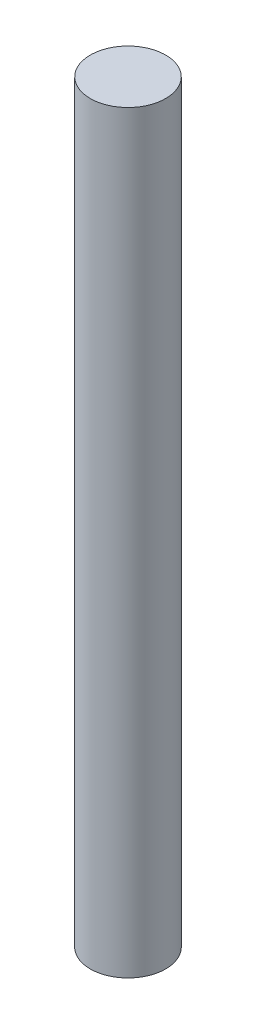
from build123d import *

# Parameters (mm, degrees)
SKETCH1_R           = 1.5
BOSS_EXTRUDE1_DEPTH = 30


with BuildPart() as part:
    # Sketch1 → Boss-Extrude1 (new body)
    with BuildSketch(Plane(origin=(0, 0, 0), x_dir=(1, 0, 0), z_dir=(0, 1, 0))):
        with Locations(Location((0, 0, 0), (0, 0, 270))):
            Circle(SKETCH1_R)
    extrude(amount=BOSS_EXTRUDE1_DEPTH)


solid = part.part
